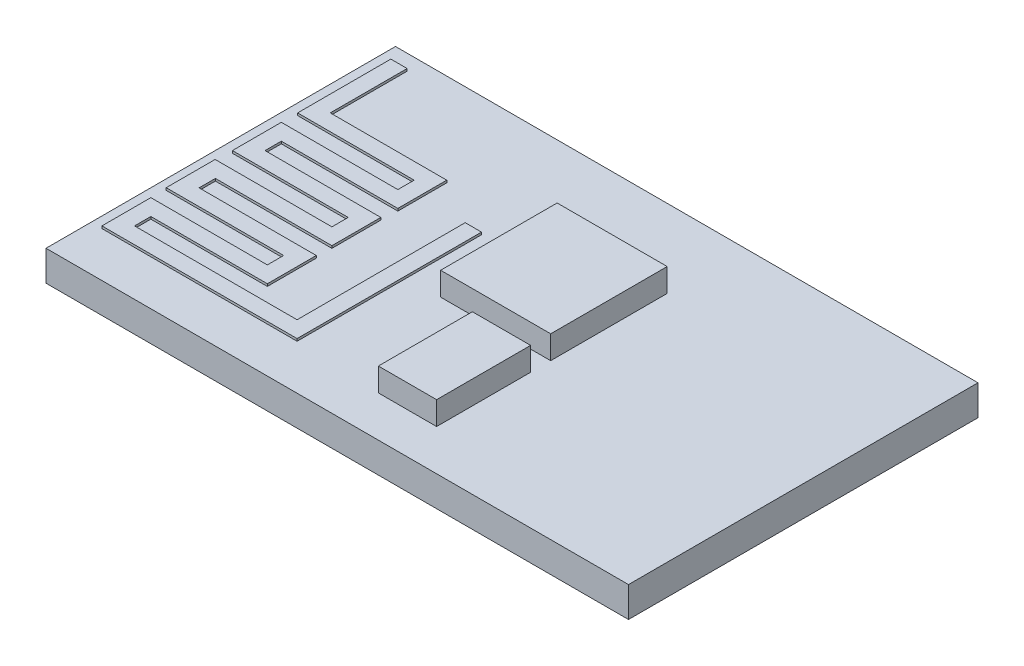
from build123d import *

# Parameters (mm, degrees)
SKETCH1_W           = 25
SKETCH1_H           = 15
BOSS_EXTRUDE1_DEPTH = 1.3
BOSS_EXTRUDE2_DEPTH = 0.1
SKETCH3_W           = 4.723765288
SKETCH3_H           = 5
SKETCH3_W_2         = 2.5
SKETCH3_H_2         = 4.03488285
BOSS_EXTRUDE3_DEPTH = 1


with BuildPart() as part:
    # Sketch1 → Boss-Extrude1 (new body)
    with BuildSketch(Plane(origin=(0, 0, 0), x_dir=(1, 0, 0), z_dir=(0, 1, 0))):
        Rectangle(SKETCH1_W, SKETCH1_H)
    extrude(amount=BOSS_EXTRUDE1_DEPTH)

    # Sketch2 → Boss-Extrude2 (add)
    with BuildSketch(Plane(origin=(0, 1.3, 0), x_dir=(1, 0, 0), z_dir=(0, 1, 0))):
        Polygon((-3.654721125, -5.569339468), (-12.030839718, -5.569339468), (-12.030839718, -3.469339468), (-7.030839718, -3.469339468), (-7.030839718, -2.769339468), (-12.071748872, -2.769339468), (-12.071748872, -0.669339468), (-7.060469733, -0.669339468), (-7.060469733, 0.030660532), (-12.030839718, 0.030660532), (-12.030839718, 2.130660532), (-7.030839718, 2.130660532), (-7.030839718, 2.830660532), (-12.030839718, 2.830660532), (-12.030839718, 6.830660532), (-11.330839718, 6.830660532), (-11.330839718, 3.530660532), (-6.330839718, 3.530660532), (-6.330839718, 1.430660532), (-11.330839718, 1.430660532), (-11.330839718, 0.730660532), (-6.360469733, 0.730660532), (-6.360469733, -1.369339468), (-11.360469733, -1.369339468), (-11.360469733, -2.069339468), (-6.330839718, -2.069339468), (-6.330839718, -4.169339468), (-11.330839718, -4.169339468), (-11.330839718, -4.869339468), (-4.354721125, -4.869339468), (-4.354721125, 2.346150012), (-3.654721125, 2.346150012), align=None)
    extrude(amount=BOSS_EXTRUDE2_DEPTH)

    # Sketch3 → Boss-Extrude3 (add)
    with BuildSketch(Plane(origin=(0, 1.3, 0), x_dir=(1, 0, 0), z_dir=(0, 1, 0))):
        with Locations((0.147617665, 1.651198425)):
            Rectangle(SKETCH3_W, SKETCH3_H)
        with Locations((1.259500309, -3.727346048)):
            Rectangle(SKETCH3_W_2, SKETCH3_H_2)
    extrude(amount=BOSS_EXTRUDE3_DEPTH)


solid = part.part
